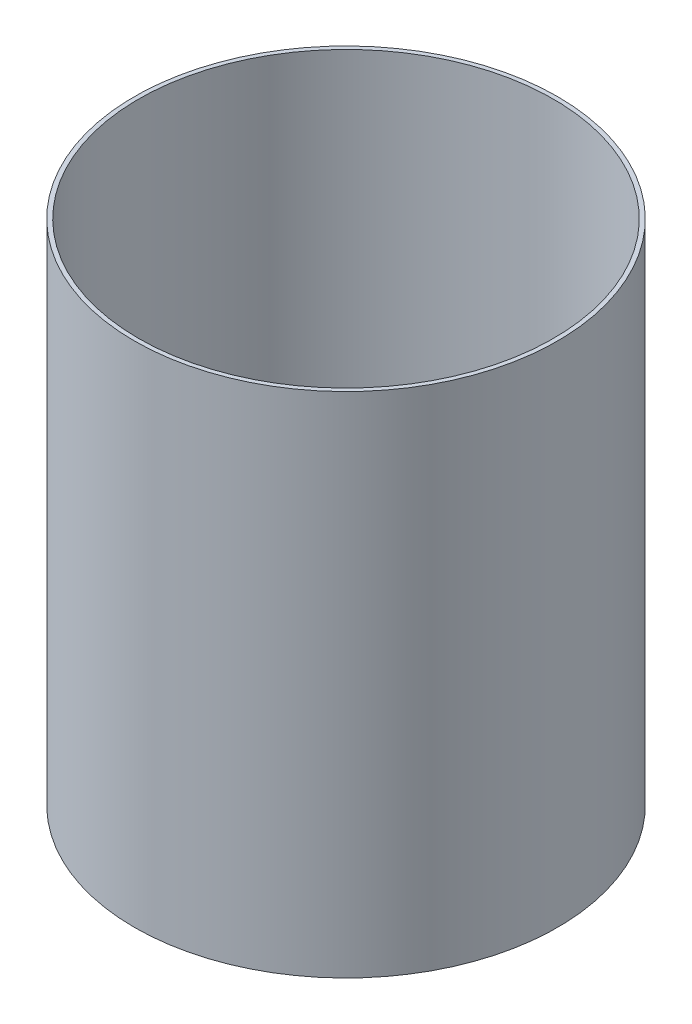
from build123d import *

# Parameters (mm, degrees)
SKETCH1_R           = 100
SKETCH1_R_2         = 98
BOSS_EXTRUDE1_DEPTH = 240


with BuildPart() as part:
    # Sketch1 → Boss-Extrude1 (new body)
    with BuildSketch(Plane(origin=(0, 0, 0), x_dir=(1, 0, 0), z_dir=(0, 1, 0))):
        with Locations(Location((0, 0, 0), (0, 0, 270))):
            Circle(SKETCH1_R)
        with Locations(Location((0, 0, 0), (0, 0, 270))):
            Circle(SKETCH1_R_2, mode=Mode.SUBTRACT)
    extrude(amount=BOSS_EXTRUDE1_DEPTH)


solid = part.part
